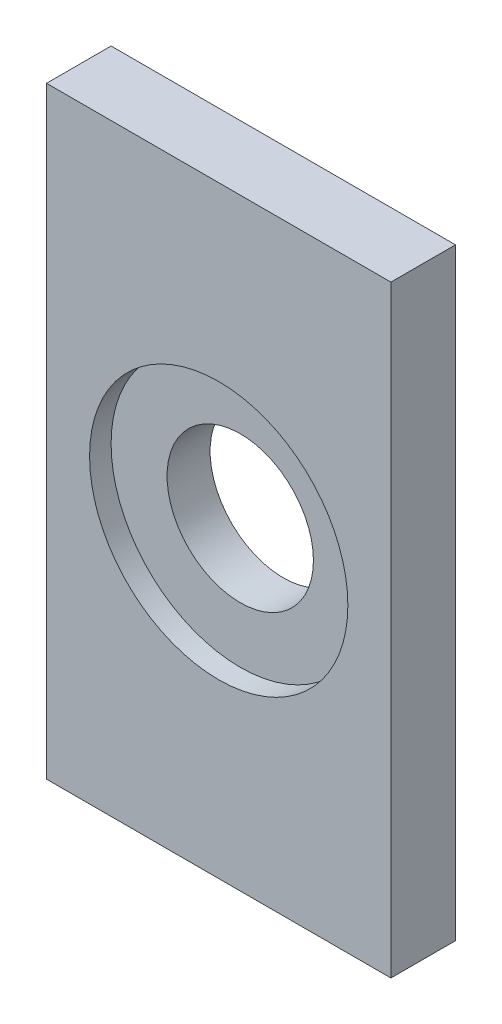
from build123d import *

# Parameters (mm, degrees)
SKETCH_1_W          = 8
SKETCH_1_H          = 14
SKETCH_1_R          = 1.7
EXTRUDE_1_DEPTH     = 1.5
SKETCH_2_R          = 3
CUT_EXTRUDE_1_DEPTH = 0.5


with BuildPart() as part:
    # Эскиз1 → Бобышка-Вытянуть1 (new body)
    with BuildSketch(Plane.XY):
        Rectangle(SKETCH_1_W, SKETCH_1_H)
        Circle(SKETCH_1_R, mode=Mode.SUBTRACT)
    extrude(amount=EXTRUDE_1_DEPTH)

    # Эскиз2 → Вырез-Вытянуть1 (cut)
    with BuildSketch(Plane.XY.offset(1.5)):
        Circle(SKETCH_2_R)
    extrude(amount=-CUT_EXTRUDE_1_DEPTH, mode=Mode.SUBTRACT)


solid = part.part
